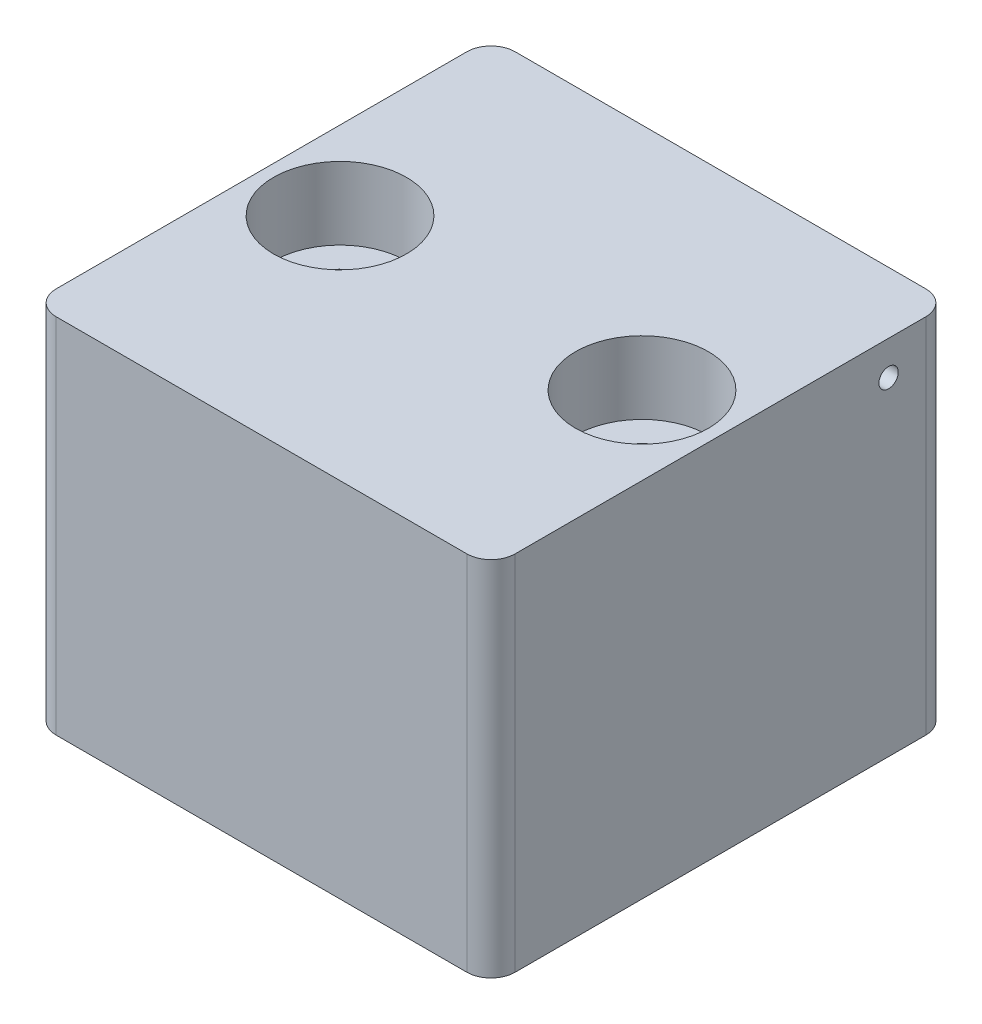
from build123d import *

# Parameters (mm, degrees)
BOSS_EXTRUDE1_DEPTH = 15
CUT_EXTRUDE1_REACH  = 32.773
SKETCH2_R           = 1.525
SKETCH3_R           = 2.75
CUT_EXTRUDE2_DEPTH  = 3
CUT_EXTRUDE3_REACH  = 32.773
SKETCH4_R           = 0.4


with BuildPart() as part:
    # Sketch1 → Boss-Extrude1 (new body)
    with BuildSketch(Plane(origin=(0, 0, 0), x_dir=(1, 0, 0), z_dir=(0, 1, 0))):
        with BuildLine():
            Line((1, 0), (18, 0))
            ThreePointArc((18, 0), (18.707106781, 0.292893219), (19, 1))
            Line((19, 1), (19, 18))
            ThreePointArc((19, 18), (18.707106781, 18.707106781), (18, 19))
            Line((18, 19), (1, 19))
            ThreePointArc((1, 19), (0.292893219, 18.707106781), (0, 18))
            Line((0, 18), (0, 1))
            ThreePointArc((0, 1), (0.292893219, 0.292893219), (1, 0))
        make_face()
    extrude(amount=BOSS_EXTRUDE1_DEPTH)

    # Sketch2 → Cut-Extrude1 (cut, up to next)
    with BuildSketch(Plane(origin=(0, 15, 0), x_dir=(1, 0, 0), z_dir=(0, 1, 0)), mode=Mode.PRIVATE) as cut_extrude1_sk1:
        with Locations(Location((3.25, 9.5, 0), (0, 0, 270))):
            Circle(SKETCH2_R)
    cut_extrude1_tool1 = extrude(cut_extrude1_sk1.sketch, amount=-CUT_EXTRUDE1_REACH, mode=Mode.PRIVATE) & part.part
    # Sketch2 → Cut-Extrude1 (cut, up to next)
    with BuildSketch(Plane(origin=(0, 15, 0), x_dir=(1, 0, 0), z_dir=(0, 1, 0)), mode=Mode.PRIVATE) as cut_extrude1_sk2:
        with Locations(Location((15.75, 9.5, 0), (0, 0, 270))):
            Circle(SKETCH2_R)
    cut_extrude1_tool2 = extrude(cut_extrude1_sk2.sketch, amount=-CUT_EXTRUDE1_REACH, mode=Mode.PRIVATE) & part.part
    add(cut_extrude1_tool1.solids().sort_by_distance((3.25, 15, -9.5))[0], mode=Mode.SUBTRACT)
    add(cut_extrude1_tool2.solids().sort_by_distance((15.75, 15, -9.5))[0], mode=Mode.SUBTRACT)

    # Sketch3 → Cut-Extrude2 (cut)
    with BuildSketch(Plane(origin=(0, 15, 0), x_dir=(1, 0, 0), z_dir=(0, 1, 0))):
        with Locations(Location((3.25, 9.5, 0), (0, 0, 270))):
            Circle(SKETCH3_R)
        with Locations(Location((15.75, 9.5, 0), (0, 0, 270))):
            Circle(SKETCH3_R)
    extrude(amount=-CUT_EXTRUDE2_DEPTH, mode=Mode.SUBTRACT)

    # Sketch4 → Cut-Extrude3 (cut, up to next)
    with BuildSketch(Plane.ZY, mode=Mode.PRIVATE) as cut_extrude3_sk1:
        with Locations((-16.458209363, 13.587683821)):
            Circle(SKETCH4_R)
    cut_extrude3_tool1 = extrude(cut_extrude3_sk1.sketch, amount=-CUT_EXTRUDE3_REACH, mode=Mode.PRIVATE) & part.part
    add(cut_extrude3_tool1.solids().sort_by_distance((0, 13.587684, -16.458209))[0], mode=Mode.SUBTRACT)


solid = part.part
